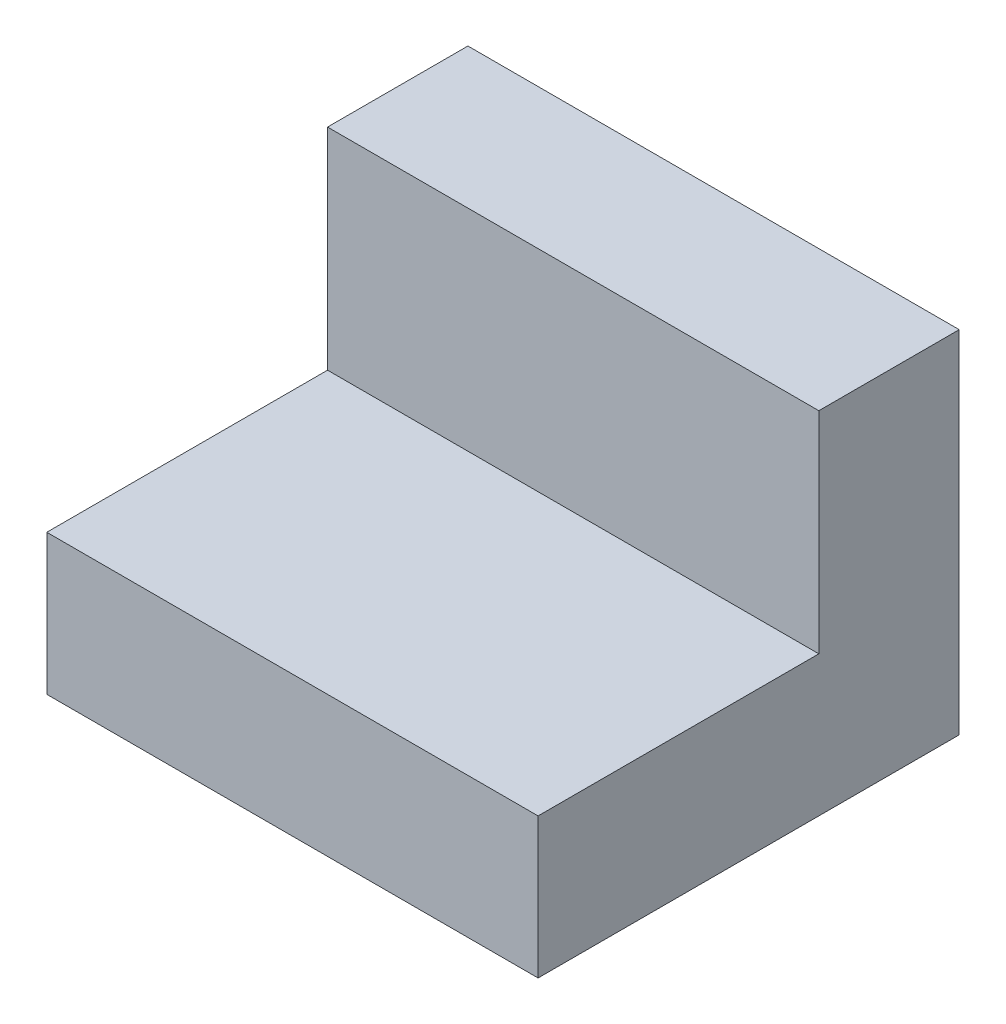
from build123d import *

# Parameters (mm, degrees)
ESBO_O1_W                = 70
ESBO_O1_H                = 20
RESSALTO_EXTRUS_O1_DEPTH = 40
ESBO_O2_W                = 70
ESBO_O2_H                = 50
RESSALTO_EXTRUS_O2_DEPTH = 20


with BuildPart() as part:
    # Esboço1 → Ressalto-extrusão1 (new body)
    with BuildSketch(Plane.XY):
        with Locations((35, 10)):
            Rectangle(ESBO_O1_W, ESBO_O1_H)
    extrude(amount=RESSALTO_EXTRUS_O1_DEPTH)

    # Esboço2 → Ressalto-extrusão2 (add)
    with BuildSketch(Plane(origin=(0, 0, 0), x_dir=(-1, 0, 0), z_dir=(0, 0, -1))):
        with Locations((-35, 25)):
            Rectangle(ESBO_O2_W, ESBO_O2_H)
    extrude(amount=RESSALTO_EXTRUS_O2_DEPTH)


solid = part.part
